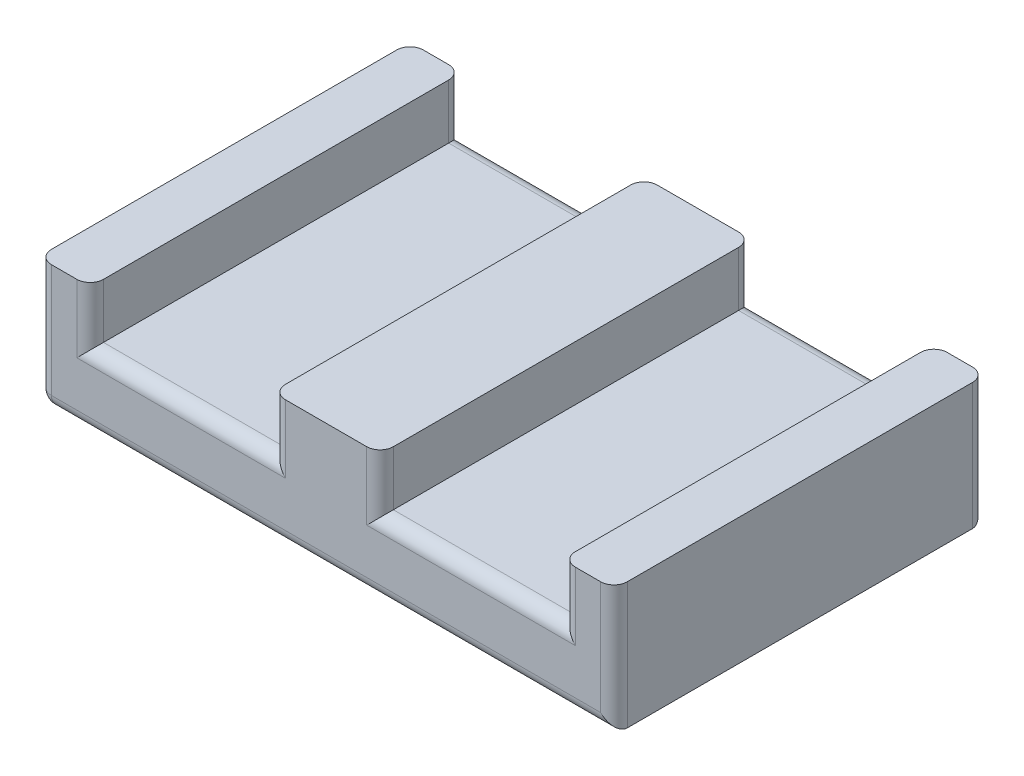
from build123d import *

# Parameters (mm, degrees)
SKETCH_1_W      = 43.2
SKETCH_1_H      = 27.9
EXTRUDE_1_DEPTH = 5.4
SKETCH_2_W      = 8.1
SKETCH_2_H      = 27.9
SKETCH_2_W_2    = 3.9
EXTRUDE_2_DEPTH = 4.1
FILLET_1_R      = 1


with BuildPart() as part:
    # Эскиз1 → Бобышка-Вытянуть1 (new body)
    with BuildSketch(Plane(origin=(0, 0, 0), x_dir=(1, 0, 0), z_dir=(0, 1, 0))):
        Rectangle(SKETCH_1_W, SKETCH_1_H)
    extrude(amount=EXTRUDE_1_DEPTH)

    # Эскиз2 → Бобышка-Вытянуть2 (add)
    with BuildSketch(Plane(origin=(0, 5.4, 0), x_dir=(1, 0, 0), z_dir=(0, 1, 0))):
        Rectangle(SKETCH_2_W, SKETCH_2_H)
        with Locations((-19.65, 0)):
            Rectangle(SKETCH_2_W_2, SKETCH_2_H)
        with Locations((19.65, 0)):
            Rectangle(SKETCH_2_W_2, SKETCH_2_H)
    extrude(amount=EXTRUDE_2_DEPTH)

    # Скругление1
    fillet_1_edges = [part.edges().sort_by_distance(p)[0] for p in [
        (-10.875, 5.4, -13.95),
        (10.875, 5.4, 13.95),
        (4.05, 7.45, 13.95),
        (4.05, 7.45, -13.95),
        (-4.05, 7.45, -13.95),
        (-4.05, 7.45, 13.95),
        (-10.875, 5.4, 13.95),
        (-17.7, 7.45, 13.95),
        (-17.7, 7.45, -13.95),
        (10.875, 5.4, -13.95),
        (17.7, 7.45, -13.95),
        (17.7, 7.45, 13.95),
        (0, 0, 13.95),
        (-21.6, 0, 0),
        (0, 0, -13.95),
        (21.6, 4.75, 13.95),
        (-21.6, 4.75, 13.95),
        (-21.6, 4.75, -13.95),
        (21.6, 4.75, -13.95),
    ]]
    fillet(fillet_1_edges, radius=FILLET_1_R)


solid = part.part
